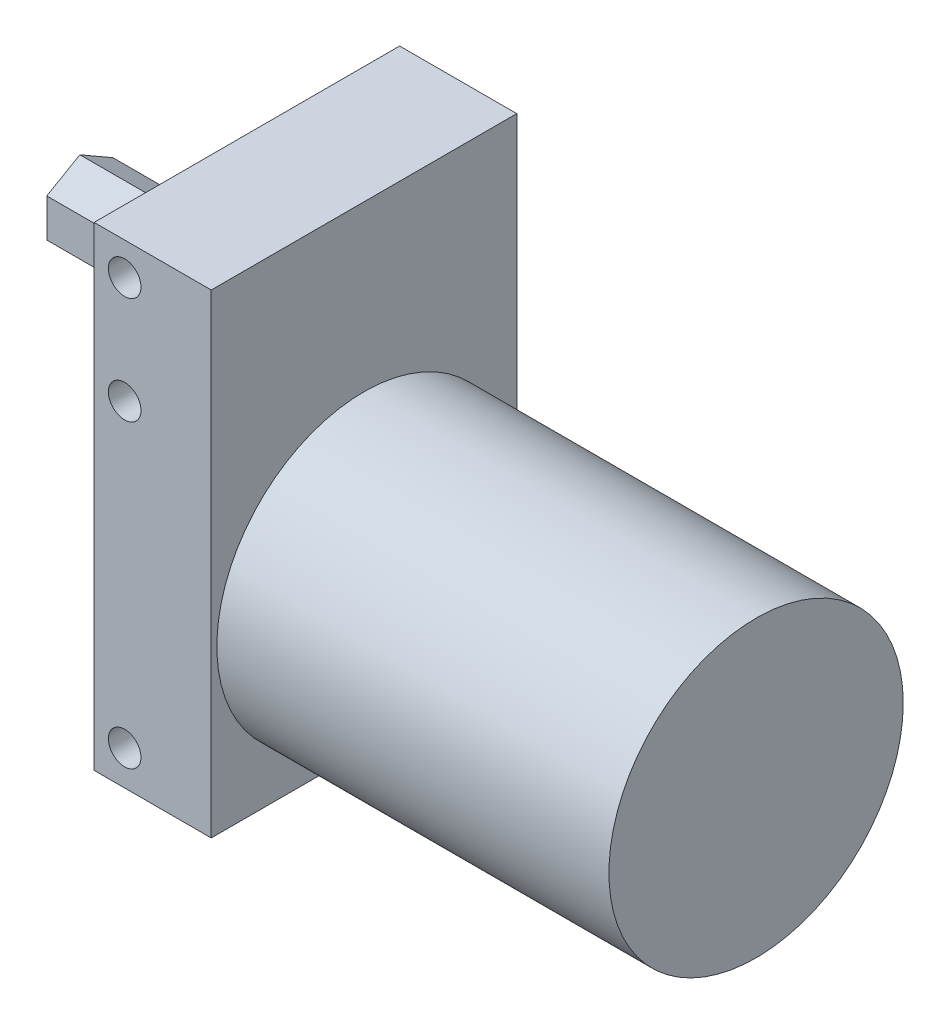
from build123d import *

# Parameters (mm, degrees)
SKETCH_1_W          = 30
SKETCH_1_H          = 46.6
EXTRUDE_1_DEPTH     = 11.5
SKETCH_1_3_R        = 7
EXTRUDE_2_DEPTH     = 2.5
SKETCH_1_4_R        = 1.6
EXTRUDE_3_DEPTH     = 16.4
SKETCH_1_5_R        = 1.6
EXTRUDE_4_DEPTH     = 10.4
SKETCH_2_R          = 14.45
EXTRUDE_5_DEPTH     = 38.5
SKETCH_3_R          = 1.6
CUT_EXTRUDE_1_DEPTH = 6
SKETCH_4_R          = 1.6
CUT_EXTRUDE_2_DEPTH = 3


with BuildPart() as part:
    # 草图1 → 凸台-拉伸1 (new body)
    with BuildSketch(Plane(origin=(0, 0, 0), x_dir=(0, 0, -1), z_dir=(1, 0, 0))):
        with Locations((15, 23.3)):
            Rectangle(SKETCH_1_W, SKETCH_1_H)
    extrude(amount=EXTRUDE_1_DEPTH)

    # 草图1<3> → 凸台-拉伸2 (add)
    with BuildSketch(Plane(origin=(0, 0, 0), x_dir=(0, 0, -1), z_dir=(1, 0, 0))):
        with Locations((15, 32.9)):
            Circle(SKETCH_1_3_R)
        Polygon((15, 36.65277675), (18.25, 34.776388375), (18.25, 31.023611625), (15, 29.14722325), (11.75, 31.023611625), (11.75, 34.776388375), align=None, mode=Mode.SUBTRACT)
    extrude(amount=-EXTRUDE_2_DEPTH)

    # 草图1<4> → 凸台-拉伸3 (add)
    with BuildSketch(Plane(origin=(0, 0, 0), x_dir=(0, 0, -1), z_dir=(1, 0, 0))):
        Polygon((18.25, 31.023611625), (18.25, 34.776388375), (15, 36.65277675), (11.75, 34.776388375), (11.75, 31.023611625), (15, 29.14722325), align=None)
        with Locations((15, 32.9)):
            Circle(SKETCH_1_4_R, mode=Mode.SUBTRACT)
    extrude(amount=-EXTRUDE_3_DEPTH)

    # 草图1<5> → 凸台-拉伸4 (add)
    with BuildSketch(Plane(origin=(0, 0, 0), x_dir=(0, 0, -1), z_dir=(1, 0, 0))):
        with Locations((15, 32.9)):
            Circle(SKETCH_1_5_R)
    extrude(amount=-EXTRUDE_4_DEPTH)

    # 草图2 → 凸台-拉伸5 (add)
    with BuildSketch(Plane(origin=(11.5, 0, 0), x_dir=(0, 0, -1), z_dir=(1, 0, 0))):
        with Locations((15, 16)):
            Circle(SKETCH_2_R)
    extrude(amount=EXTRUDE_5_DEPTH)

    # 草图3 → 切除-拉伸1 (cut)
    with BuildSketch(Plane.XY):
        with Locations((3, 43.4)):
            Circle(SKETCH_3_R)
        with Locations((3, 32.9)):
            Circle(SKETCH_3_R)
        with Locations((3, 3.4)):
            Circle(SKETCH_3_R)
    extrude(amount=-CUT_EXTRUDE_1_DEPTH, mode=Mode.SUBTRACT)

    # 草图4 → 切除-拉伸2 (cut)
    with BuildSketch(Plane(origin=(0, 0, -30), x_dir=(-1, 0, 0), z_dir=(0, 0, -1))):
        with Locations((-3.2, 43.4)):
            Circle(SKETCH_4_R)
        with Locations((-3.2, 32.9)):
            Circle(SKETCH_4_R)
        with Locations((-3.2, 3.4)):
            Circle(SKETCH_4_R)
    extrude(amount=-CUT_EXTRUDE_2_DEPTH, mode=Mode.SUBTRACT)


solid = part.part
